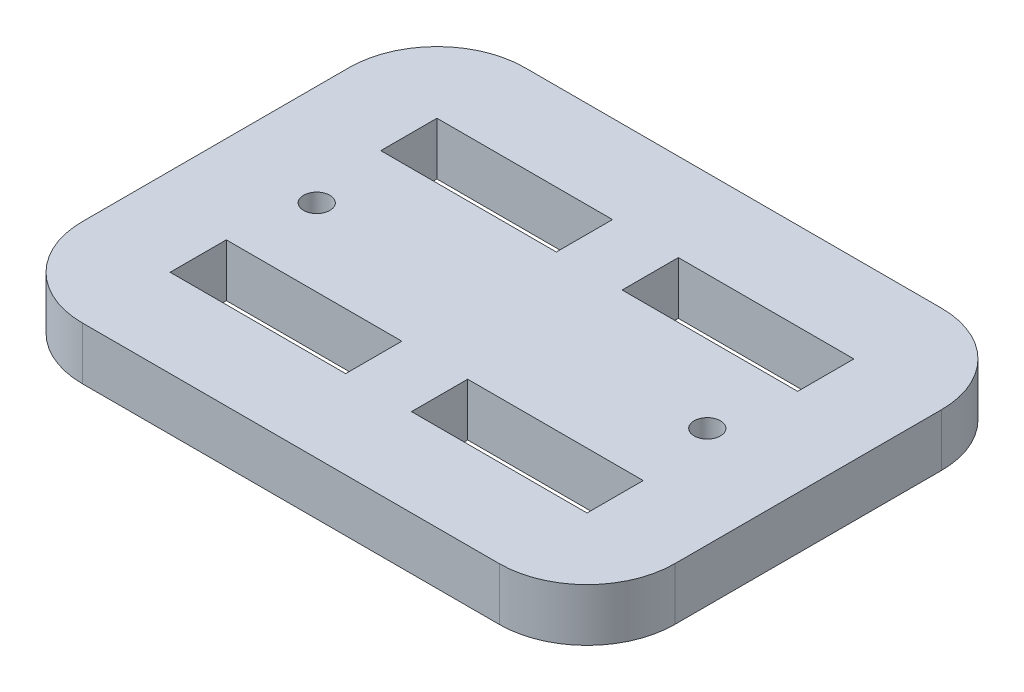
from build123d import *

# Parameters (mm, degrees)
SKETCH1_W            = 33.75
SKETCH1_H            = 50.4
SKETCH1_R            = 1.5
SKETCH1_W_2          = 20
SKETCH1_H_2          = 6.4
BOSS_EXTRUDE1_DEPTH  = 6
FILLET1_R            = 10
FILLET1_OF_MIRROR1_R = 10


with BuildPart() as part:
    # Sketch1 → Boss-Extrude1 (new body)
    with BuildSketch(Plane(origin=(0, 0, 0), x_dir=(1, 0, 0), z_dir=(0, 1, 0))):
        with Locations((-16.875, 0)):
            Rectangle(SKETCH1_W, SKETCH1_H)
        with Locations(Location((-22.25, 0, 0), (0, 0, 90))):
            Circle(SKETCH1_R, mode=Mode.SUBTRACT)
        with Locations((-13.75, 12)):
            Rectangle(SKETCH1_W_2, SKETCH1_H_2, mode=Mode.SUBTRACT)
        with Locations((-13.75, -12)):
            Rectangle(SKETCH1_W_2, SKETCH1_H_2, mode=Mode.SUBTRACT)
    boss_extrude1 = extrude(amount=BOSS_EXTRUDE1_DEPTH)

    # Fillet1
    fillet1_edges = [part.edges().sort_by_distance(p)[0] for p in [
        (-33.75, 3, -25.2),
        (-33.75, 3, 25.2),
    ]]
    fillet(fillet1_edges, radius=FILLET1_R)

    # Mirror1: Boss-Extrude1 across plane
    add(boss_extrude1.mirror(Plane(origin=(0, 6, -25.2), x_dir=(0, 0, 1), z_dir=(-1, 0, 0))))

    # Fillet1 of Mirror1
    fillet1_of_mirror1_edges = [part.edges().sort_by_distance(p)[0] for p in [
        (33.75, 3, -25.2),
        (33.75, 3, 25.2),
    ]]
    fillet(fillet1_of_mirror1_edges, radius=FILLET1_OF_MIRROR1_R)


solid = part.part
